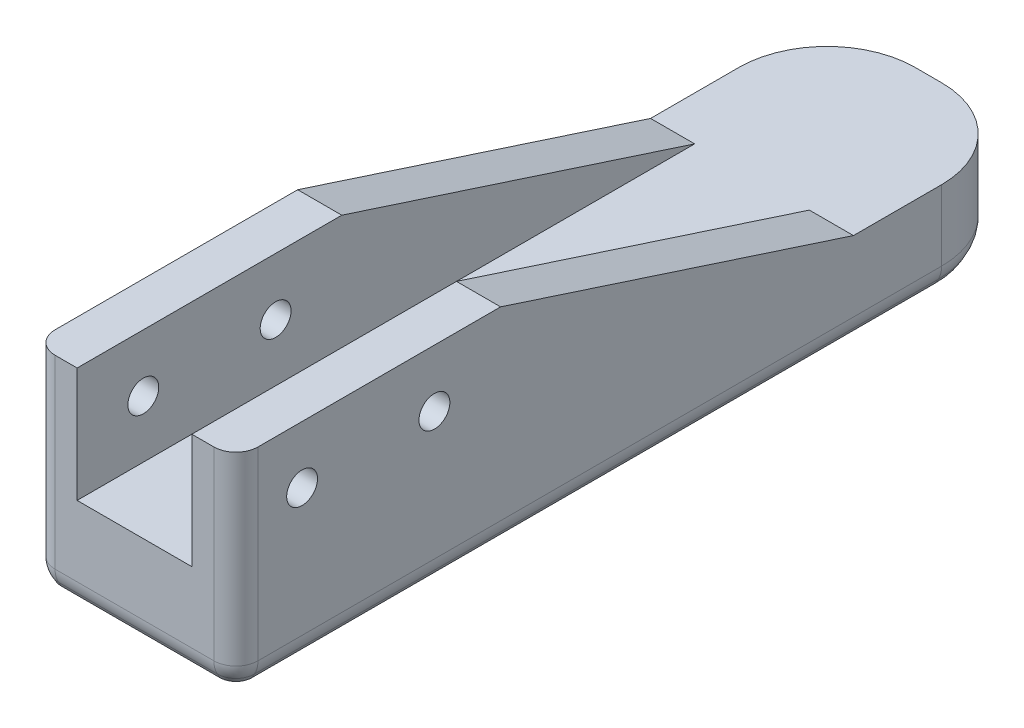
from build123d import *
from OCP.BRepFilletAPI import BRepFilletAPI_MakeChamfer

# Parameters (mm, degrees)
SKETCH_1_W               = 23
SKETCH_1_H               = 90
EXTRUDE_1_DEPTH          = 5
SKETCH_2_R               = 4.25
SKETCH_2_R_2             = 6.5
CUT_EXTRUDE_1_DEPTH      = 3.5
EXTRUDE_START            = 15
SKETCH_4_W               = 5
SKETCH_4_H               = 13
EXTRUDE_3_DEPTH          = 30
FILLET_2_R               = 10
CUT_EXTRUDE_2_DEPTH      = 50.812147113
CUT_EXTRUDE_2_DEPTH_BACK = 50.812147113
SKETCH_5_R               = 1.75
FILLET_3_R               = 2.5
EXTRUDE_START_2          = 6.5
EXTRUDE_4_DEPTH          = 5
CHAMFER_1_SIZE           = 1.2
CHAMFER_1_SIZE2          = 0.692820323
FILLET_4_R               = 3


with BuildPart() as part:
    # 스케치1 → 보스-돌출1 (new, symmetric)
    with BuildSketch(Plane(origin=(0, 0, 0), x_dir=(1, 0, 0), z_dir=(0, 1, 0))):
        Rectangle(SKETCH_1_W, SKETCH_1_H)
    extrude(amount=EXTRUDE_1_DEPTH, both=True)

    # 스케치2 → 컷-돌출1 (cut)
    with BuildSketch(Plane.XZ.offset(5)):
        with Locations((0, 24.25)):
            Circle(SKETCH_2_R)
        with BuildLine():
            ThreePointArc((4.25, 24.25), (-0.19737792, 20.004585773), (-4.231666803, 24.644329897))
            Line((-4.231666803, 24.644329897), (-6.471960993, 0.603092784))
            ThreePointArc((-6.471960993, 0.603092784), (0, 6.5), (6.471960993, 0.603092784))
            Line((6.471960993, 0.603092784), (4.231666803, 24.644329897))
            ThreePointArc((4.231666803, 24.644329897), (4.245414227, 24.44737792), (4.25, 24.25))
        make_face()
        Circle(SKETCH_2_R_2)
        with BuildLine():
            ThreePointArc((6.471960993, -0.603092784), (0, -6.5), (-6.471960993, -0.603092784))
            Line((-6.471960993, -0.603092784), (-4.231666803, -24.644329897))
            ThreePointArc((-4.231666803, -24.644329897), (-0.19737792, -20.004585773), (4.25, -24.25))
            ThreePointArc((4.25, -24.25), (4.245414227, -24.44737792), (4.231666803, -24.644329897))
            Line((4.231666803, -24.644329897), (6.471960993, -0.603092784))
        make_face()
        with Locations((0, -24.25)):
            Circle(SKETCH_2_R)
    extrude(amount=-CUT_EXTRUDE_1_DEPTH, mode=Mode.SUBTRACT)

    # 스케치4 → 보스-돌출3 (add)
    with BuildSketch(Plane.XY.offset(EXTRUDE_START)):
        with Locations((-9, 11.5)):
            Rectangle(SKETCH_4_W, SKETCH_4_H)
        with Locations((9, 11.5)):
            Rectangle(SKETCH_4_W, SKETCH_4_H)
    extrude(amount=EXTRUDE_3_DEPTH)

    # 필렛2
    fillet_2_edges = [part.edges().sort_by_distance(p)[0] for p in [
        (-11.5, 0, -45),
        (11.5, 0, -45),
    ]]
    fillet(fillet_2_edges, radius=FILLET_2_R)

    # 스케치5 → 컷-돌출2 (cut, two sides: drawn at the far end of the back side and taken through both)
    with BuildSketch(Plane(origin=(0, 0, 0), x_dir=(0, 0, -1), z_dir=(1, 0, 0)).offset(-CUT_EXTRUDE_2_DEPTH_BACK)):
        with Locations((-22.5, 11.5)):
            Circle(SKETCH_5_R)
        with Locations((-37.5, 11.5)):
            Circle(SKETCH_5_R)
    extrude(amount=CUT_EXTRUDE_2_DEPTH + CUT_EXTRUDE_2_DEPTH_BACK, mode=Mode.SUBTRACT)

    # 필렛3
    fillet_3_edges = [part.edges().sort_by_distance(p)[0] for p in [
        (11.5, 6.5, 45),
        (-11.5, 6.5, 45),
    ]]
    fillet(fillet_3_edges, radius=FILLET_3_R)

    # 스케치6 → 보스-돌출4 (add)
    with BuildSketch(Plane(origin=(0, 0, 0), x_dir=(0, 0, -1), z_dir=(1, 0, 0)).offset(EXTRUDE_START_2)):
        Polygon((-15, 18), (25, 5), (-15, 5), align=None)
    extrude_4 = extrude(amount=EXTRUDE_4_DEPTH)

    # 대칭 복사1: 보스-돌출4 across plane
    add(extrude_4.mirror(Plane(origin=(0, 0, 0), x_dir=(0, 0, 1), z_dir=(1, 0, 0))))

    # 모따기1: one chamfer whose edges measure the first distance from different faces: ONE call of the kernel's chamfer builder (chamfer() names one face for all edges)
    chamfer_1_edges_1 = [part.edges().sort_by_distance(p)[0] for p in [
        (5.351813898, -5, 12.62371134),
    ]]
    chamfer_1_side_1 = [part.faces().sort_by_distance(p)[0] for p in [
        (5.351813898, -3.25, 12.62371134),
    ]]
    chamfer_1_edges_2 = [part.edges().sort_by_distance(p)[0] for p in [
        (5.351813898, -5, -12.62371134),
    ]]
    chamfer_1_side_2 = [part.faces().sort_by_distance(p)[0] for p in [
        (5.351813898, -3.25, -12.62371134),
    ]]
    chamfer_1_edges_3 = [part.edges().sort_by_distance(p)[0] for p in [
        (0, -5, 28.5),
    ]]
    chamfer_1_side_3 = [part.faces().sort_by_distance(p)[0] for p in [
        (0, -3.25, 28.5),
    ]]
    chamfer_1_edges_4 = [part.edges().sort_by_distance(p)[0] for p in [
        (-5.351813898, -5, 12.62371134),
    ]]
    chamfer_1_side_4 = [part.faces().sort_by_distance(p)[0] for p in [
        (-5.351813898, -3.25, 12.62371134),
    ]]
    chamfer_1_edges_5 = [part.edges().sort_by_distance(p)[0] for p in [
        (-6.5, -5, 0),
    ]]
    chamfer_1_side_5 = [part.faces().sort_by_distance(p)[0] for p in [
        (-6.5, -3.25, 0),
    ]]
    chamfer_1_edges_6 = [part.edges().sort_by_distance(p)[0] for p in [
        (-5.351813898, -5, -12.62371134),
    ]]
    chamfer_1_side_6 = [part.faces().sort_by_distance(p)[0] for p in [
        (-5.351813898, -3.25, -12.62371134),
    ]]
    chamfer_1_edges_7 = [part.edges().sort_by_distance(p)[0] for p in [
        (0, -5, -28.5),
    ]]
    chamfer_1_side_7 = [part.faces().sort_by_distance(p)[0] for p in [
        (0, -3.25, -28.5),
    ]]
    chamfer_1_edges_8 = [part.edges().sort_by_distance(p)[0] for p in [
        (6.5, -5, 0),
    ]]
    chamfer_1_side_8 = [part.faces().sort_by_distance(p)[0] for p in [
        (6.5, -3.25, 0),
    ]]
    chamfer_1_edges_9 = [part.edges().sort_by_distance(p)[0] for p in [
        (0, -5, -45),
    ]]
    chamfer_1_side_9 = [part.faces().sort_by_distance(p)[0] for p in [
        (0, 0, -45),
    ]]
    chamfer_1_edges_10 = [part.edges().sort_by_distance(p)[0] for p in [
        (-11.5, -5, 3.75),
    ]]
    chamfer_1_side_10 = [part.faces().sort_by_distance(p)[0] for p in [
        (-11.5, 4.599741569, 9.495989177),
    ]]
    chamfer_1_edges_11 = [part.edges().sort_by_distance(p)[0] for p in [
        (-8.571067812, -5, -42.071067812),
    ]]
    chamfer_1_side_11 = [part.faces().sort_by_distance(p)[0] for p in [
        (-8.571067812, 0, -42.071067812),
    ]]
    chamfer_1_edges_12 = [part.edges().sort_by_distance(p)[0] for p in [
        (8.571067812, -5, -42.071067812),
    ]]
    chamfer_1_side_12 = [part.faces().sort_by_distance(p)[0] for p in [
        (8.571067812, 0, -42.071067812),
    ]]
    chamfer_1_edges_13 = [part.edges().sort_by_distance(p)[0] for p in [
        (0, -5, 45),
    ]]
    chamfer_1_side_13 = [part.faces().sort_by_distance(p)[0] for p in [
        (0, 3.051020408, 45),
    ]]
    chamfer_1_edges_14 = [part.edges().sort_by_distance(p)[0] for p in [
        (11.5, -5, 3.75),
    ]]
    chamfer_1_side_14 = [part.faces().sort_by_distance(p)[0] for p in [
        (11.5, 4.599741569, 9.495989177),
    ]]
    chamfer_1_edges_15 = [part.edges().sort_by_distance(p)[0] for p in [
        (10.767766953, -5, 44.267766953),
    ]]
    chamfer_1_side_15 = [part.faces().sort_by_distance(p)[0] for p in [
        (10.767766953, 6.5, 44.267766953),
    ]]
    chamfer_1_edges_16 = [part.edges().sort_by_distance(p)[0] for p in [
        (-10.767766953, -5, 44.267766953),
    ]]
    chamfer_1_side_16 = [part.faces().sort_by_distance(p)[0] for p in [
        (-10.767766953, 6.5, 44.267766953),
    ]]
    chamfer_1 = BRepFilletAPI_MakeChamfer(part.part.solid().wrapped)
    for e in chamfer_1_edges_1:
        chamfer_1.Add(CHAMFER_1_SIZE, CHAMFER_1_SIZE2, e.wrapped, chamfer_1_side_1[0].wrapped)  # the first distance lies on this face
    for e in chamfer_1_edges_2:
        chamfer_1.Add(CHAMFER_1_SIZE, CHAMFER_1_SIZE2, e.wrapped, chamfer_1_side_2[0].wrapped)  # the first distance lies on this face
    for e in chamfer_1_edges_3:
        chamfer_1.Add(CHAMFER_1_SIZE, CHAMFER_1_SIZE2, e.wrapped, chamfer_1_side_3[0].wrapped)  # the first distance lies on this face
    for e in chamfer_1_edges_4:
        chamfer_1.Add(CHAMFER_1_SIZE, CHAMFER_1_SIZE2, e.wrapped, chamfer_1_side_4[0].wrapped)  # the first distance lies on this face
    for e in chamfer_1_edges_5:
        chamfer_1.Add(CHAMFER_1_SIZE, CHAMFER_1_SIZE2, e.wrapped, chamfer_1_side_5[0].wrapped)  # the first distance lies on this face
    for e in chamfer_1_edges_6:
        chamfer_1.Add(CHAMFER_1_SIZE, CHAMFER_1_SIZE2, e.wrapped, chamfer_1_side_6[0].wrapped)  # the first distance lies on this face
    for e in chamfer_1_edges_7:
        chamfer_1.Add(CHAMFER_1_SIZE, CHAMFER_1_SIZE2, e.wrapped, chamfer_1_side_7[0].wrapped)  # the first distance lies on this face
    for e in chamfer_1_edges_8:
        chamfer_1.Add(CHAMFER_1_SIZE, CHAMFER_1_SIZE2, e.wrapped, chamfer_1_side_8[0].wrapped)  # the first distance lies on this face
    for e in chamfer_1_edges_9:
        chamfer_1.Add(CHAMFER_1_SIZE, CHAMFER_1_SIZE2, e.wrapped, chamfer_1_side_9[0].wrapped)  # the first distance lies on this face
    for e in chamfer_1_edges_10:
        chamfer_1.Add(CHAMFER_1_SIZE, CHAMFER_1_SIZE2, e.wrapped, chamfer_1_side_10[0].wrapped)  # the first distance lies on this face
    for e in chamfer_1_edges_11:
        chamfer_1.Add(CHAMFER_1_SIZE, CHAMFER_1_SIZE2, e.wrapped, chamfer_1_side_11[0].wrapped)  # the first distance lies on this face
    for e in chamfer_1_edges_12:
        chamfer_1.Add(CHAMFER_1_SIZE, CHAMFER_1_SIZE2, e.wrapped, chamfer_1_side_12[0].wrapped)  # the first distance lies on this face
    for e in chamfer_1_edges_13:
        chamfer_1.Add(CHAMFER_1_SIZE, CHAMFER_1_SIZE2, e.wrapped, chamfer_1_side_13[0].wrapped)  # the first distance lies on this face
    for e in chamfer_1_edges_14:
        chamfer_1.Add(CHAMFER_1_SIZE, CHAMFER_1_SIZE2, e.wrapped, chamfer_1_side_14[0].wrapped)  # the first distance lies on this face
    for e in chamfer_1_edges_15:
        chamfer_1.Add(CHAMFER_1_SIZE, CHAMFER_1_SIZE2, e.wrapped, chamfer_1_side_15[0].wrapped)  # the first distance lies on this face
    for e in chamfer_1_edges_16:
        chamfer_1.Add(CHAMFER_1_SIZE, CHAMFER_1_SIZE2, e.wrapped, chamfer_1_side_16[0].wrapped)  # the first distance lies on this face
    add(Compound.cast(chamfer_1.Shape()), mode=Mode.REPLACE)

    # 필렛4
    fillet_4_edges = [part.edges().sort_by_distance(p)[0] for p in [
        (5.351813898, -3.8, -12.62371134),
        (6.5, -3.8, 0),
        (0, -3.8, -28.5),
        (5.351813898, -3.8, 12.62371134),
        (-5.351813898, -3.8, -12.62371134),
        (0, -3.8, 28.5),
        (-6.5, -3.8, 0),
        (-5.351813898, -3.8, 12.62371134),
        (-11.5, -3.8, 3.75),
        (-10.767766953, -3.8, 44.267766953),
        (-8.571067812, -3.8, -42.071067812),
        (0, -3.8, 45),
        (0, -3.8, -45),
        (10.767766953, -3.8, 44.267766953),
        (8.571067812, -3.8, -42.071067812),
        (11.5, -3.8, 3.75),
    ]]
    fillet(fillet_4_edges, radius=FILLET_4_R)


solid = part.part
